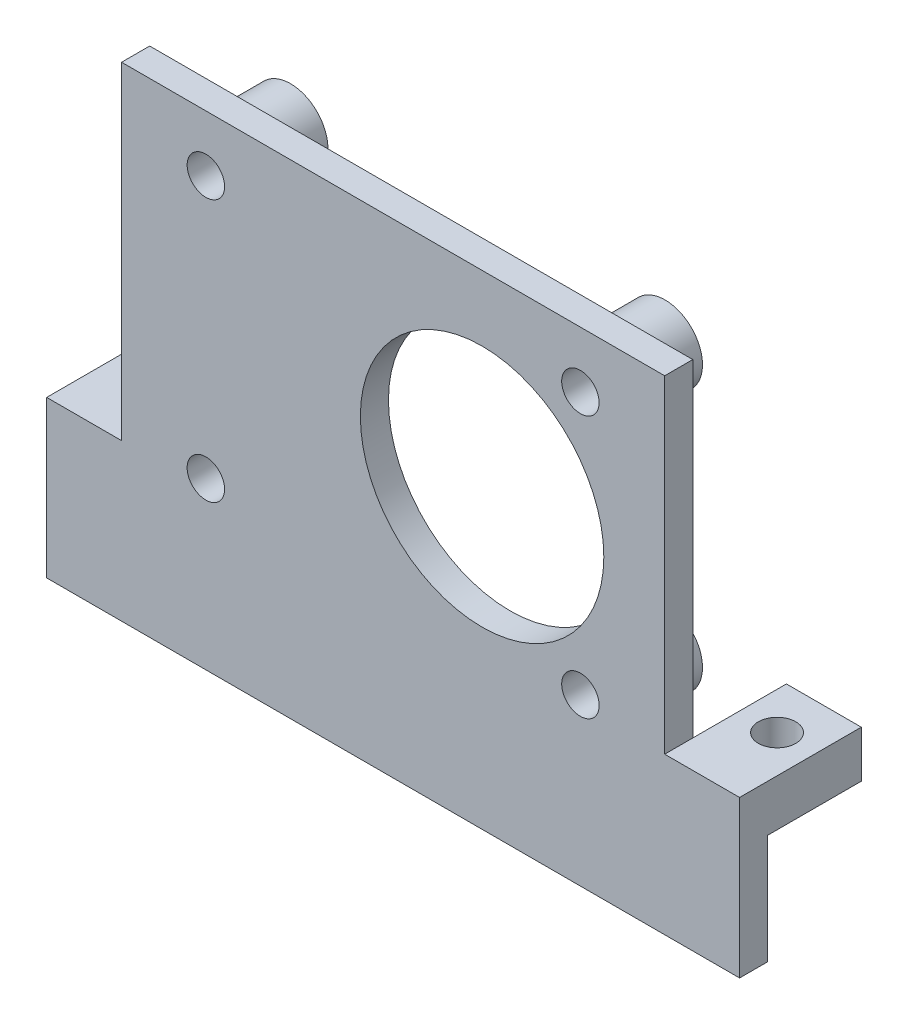
from build123d import *

# Parameters (mm, degrees)
SKETCH1_R             = 4
SKETCH1_R_2           = 2
BOSS_EXTRUDE2_DEPTH   = 6.038447986
BOSS_EXTRUDE2_2_DEPTH = 6.038447986
BOSS_EXTRUDE2_3_DEPTH = 6.038447986
BOSS_EXTRUDE2_4_DEPTH = 6.038447986
BOSS_EXTRUDE4_DEPTH   = 3
SKETCH2_W             = 8
SKETCH2_H             = 10
SKETCH2_R             = 2
BOSS_EXTRUDE3_DEPTH   = 5
SKETCH1_4_R           = 2
SKETCH1_4_R_2         = 13
CUT_EXTRUDE1_DEPTH    = 10


with BuildPart() as part:
    # Sketch1 → Boss-Extrude2 (new body)
    with BuildSketch(Plane.XY):
        with Locations((49, 35.83595021)):
            Circle(SKETCH1_R)
        with Locations((49, 35.83595021)):
            Circle(SKETCH1_R_2, mode=Mode.SUBTRACT)
    extrude(amount=BOSS_EXTRUDE2_DEPTH)



with BuildPart() as body_2:
    # Sketch1 → Boss-Extrude2 2 (new body)
    with BuildSketch(Plane.XY):
        with Locations((49, 7.83595021)):
            Circle(SKETCH1_R)
        with Locations((49, 7.83595021)):
            Circle(SKETCH1_R_2, mode=Mode.SUBTRACT)
    extrude(amount=BOSS_EXTRUDE2_2_DEPTH)


with BuildPart() as body_3:
    # Sketch1 → Boss-Extrude2 3 (new body)
    with BuildSketch(Plane.XY):
        with Locations((9, 7.83595021)):
            Circle(SKETCH1_R)
        with Locations((9, 7.83595021)):
            Circle(SKETCH1_R_2, mode=Mode.SUBTRACT)
    extrude(amount=BOSS_EXTRUDE2_3_DEPTH)


with BuildPart() as body_4:
    # Sketch1 → Boss-Extrude2 4 (new body)
    with BuildSketch(Plane.XY):
        with Locations((9, 35.83595021)):
            Circle(SKETCH1_R)
        with Locations((9, 35.83595021)):
            Circle(SKETCH1_R_2, mode=Mode.SUBTRACT)
    extrude(amount=BOSS_EXTRUDE2_4_DEPTH)


with BuildPart() as part_1:
    add(part.part)

    add(body_2.part)  # Boss-Extrude4 merges body 2

    add(body_3.part)  # Boss-Extrude4 merges body 3

    add(body_4.part)  # Boss-Extrude4 merges body 4
    # Sketch3 → Boss-Extrude4 (add)
    with BuildSketch(Plane.XY.offset(6.038447986)):
        Polygon((-8, 6.83595021), (-8, -9.86404979), (66, -9.86404979), (66, 6.83595021), (58, 6.83595021), (58, 41.83595021), (0, 41.83595021), (0, 6.83595021), align=None)
    extrude(amount=BOSS_EXTRUDE4_DEPTH)

    # Sketch2 → Boss-Extrude3 (add)
    # profile 1 of 2: a face of its own
    with BuildSketch(Plane(origin=(0, 1.83595021, 0), x_dir=(1, 0, 0), z_dir=(0, 1, 0))):
        with Locations((-4, -1.038447986)):
            Rectangle(SKETCH2_W, SKETCH2_H)
        with Locations(Location((-4, -1.038447986, 0), (0, 0, 270))):
            Circle(SKETCH2_R, mode=Mode.SUBTRACT)
    # profile 2 of 2: a face of its own
    with BuildSketch(Plane(origin=(0, 1.83595021, 0), x_dir=(1, 0, 0), z_dir=(0, 1, 0))):
        with Locations((62, -1.038447986)):
            Rectangle(SKETCH2_W, SKETCH2_H)
        with Locations(Location((62, -1.038447986, 0), (0, 0, 270))):
            Circle(SKETCH2_R, mode=Mode.SUBTRACT)
    extrude(amount=BOSS_EXTRUDE3_DEPTH)

    # Sketch1<4> → Cut-Extrude1 (cut)
    with BuildSketch(Plane.XY):
        with Locations((9, 35.83595021)):
            Circle(SKETCH1_4_R)
        with Locations((9, 7.83595021)):
            Circle(SKETCH1_4_R)
        with Locations((49, 35.83595021)):
            Circle(SKETCH1_4_R)
        with Locations((38.5, 21.83595021)):
            Circle(SKETCH1_4_R_2)
        with Locations((49, 7.83595021)):
            Circle(SKETCH1_4_R)
    extrude(amount=CUT_EXTRUDE1_DEPTH, mode=Mode.SUBTRACT)


solid = part_1.part
